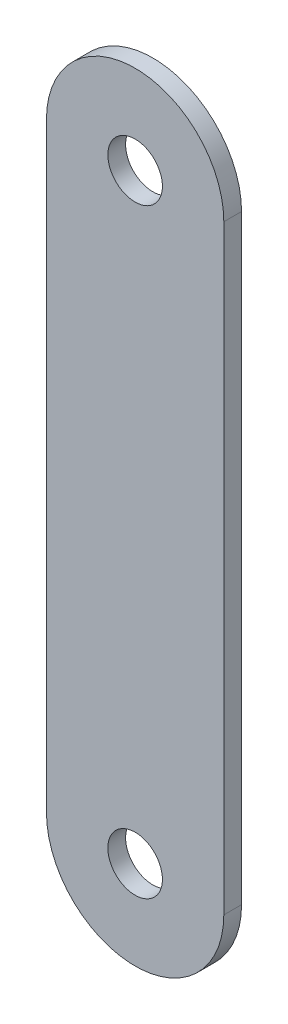
from build123d import *

# Parameters (mm, degrees)
SKETCH_1_R      = 2
EXTRUDE_1_DEPTH = 1.3


with BuildPart() as part:
    # 草图1 → 凸台-拉伸1 (new body)
    with BuildSketch(Plane.XY):
        with BuildLine():
            Line((-6.5, -22), (-6.5, 22))
            ThreePointArc((-6.5, 22), (0, 28.5), (6.5, 22))
            Line((6.5, 22), (6.5, -22))
            ThreePointArc((6.5, -22), (0, -28.5), (-6.5, -22))
        make_face()
        with Locations((0, 22)):
            Circle(SKETCH_1_R, mode=Mode.SUBTRACT)
        with Locations((0, -22)):
            Circle(SKETCH_1_R, mode=Mode.SUBTRACT)
    extrude(amount=EXTRUDE_1_DEPTH)


solid = part.part
